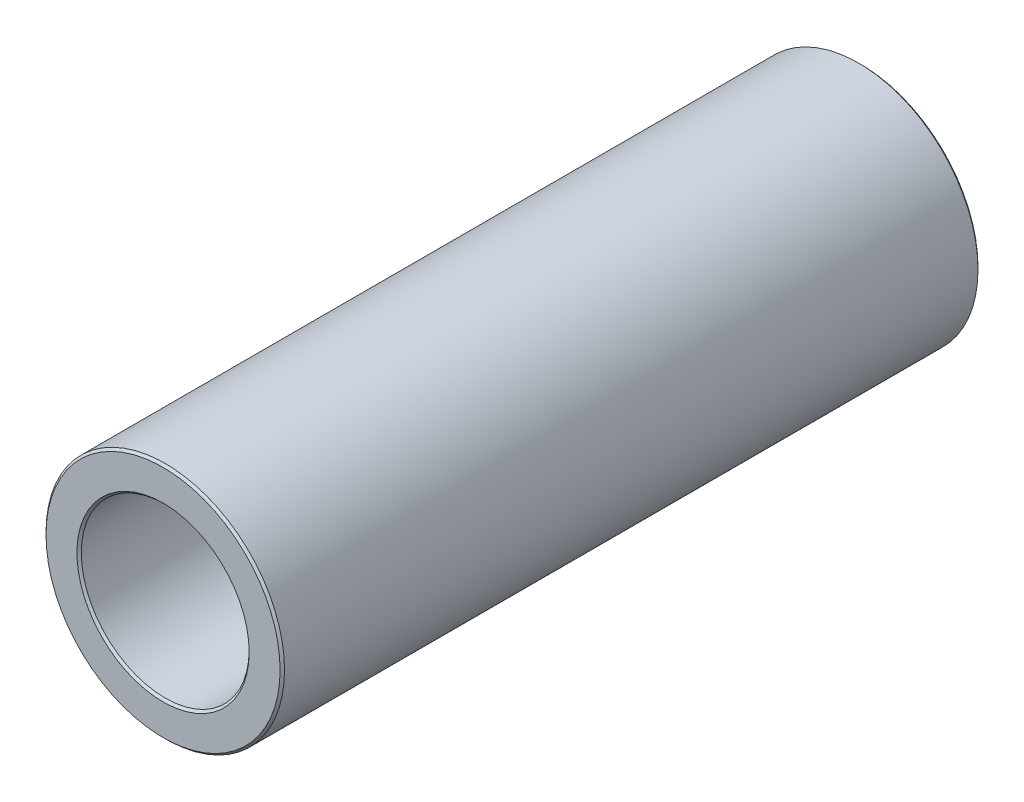
from build123d import *

# Parameters (mm, degrees)
SKIZZE1_R                       = 27
SKIZZE1_R_2                     = 19
AUFSATZ_LINEAR_AUSTRAGEN1_DEPTH = 79
FASE1_SIZE                      = 0.5


with BuildPart() as part:
    # Skizze1 → Aufsatz-Linear austragen1 (new, symmetric)
    with BuildSketch(Plane.XY):
        Circle(SKIZZE1_R)
        Circle(SKIZZE1_R_2, mode=Mode.SUBTRACT)
    extrude(amount=AUFSATZ_LINEAR_AUSTRAGEN1_DEPTH, both=True)

    # Fase1
    fase1_edges = [part.edges().sort_by_distance(p)[0] for p in [
        (-27, 0, -79),
        (-27, 0, 79),
        (-19, 0, -79),
        (-19, 0, 79),
    ]]
    chamfer(fase1_edges, length=FASE1_SIZE)


solid = part.part
